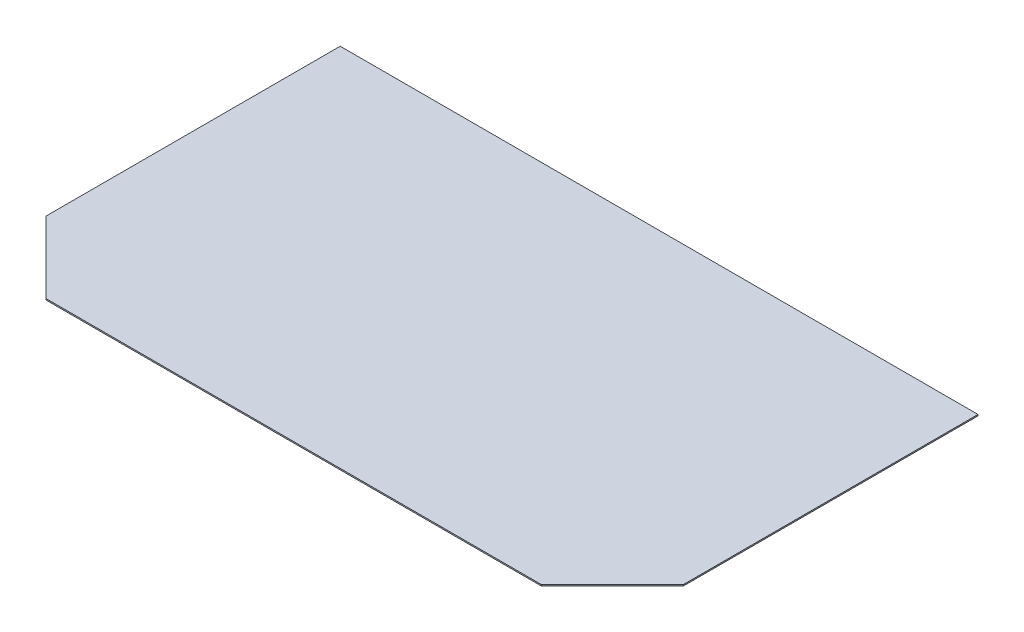
from build123d import *

# Parameters (mm, degrees)
DOPED_GERMANIUM_DEPTH = 0.14


with BuildPart() as part:
    # Sketch1 → Doped Germanium (new body)
    with BuildSketch(Plane(origin=(0, 0, 0), x_dir=(1, 0, 0), z_dir=(0, 1, 0))):
        Polygon((0, 0), (0, -31.783135352), (7.716864648, -39.5), (61.183135352, -39.5), (68.9, -31.783135352), (68.9, 0), align=None)
    extrude(amount=DOPED_GERMANIUM_DEPTH)


solid = part.part
